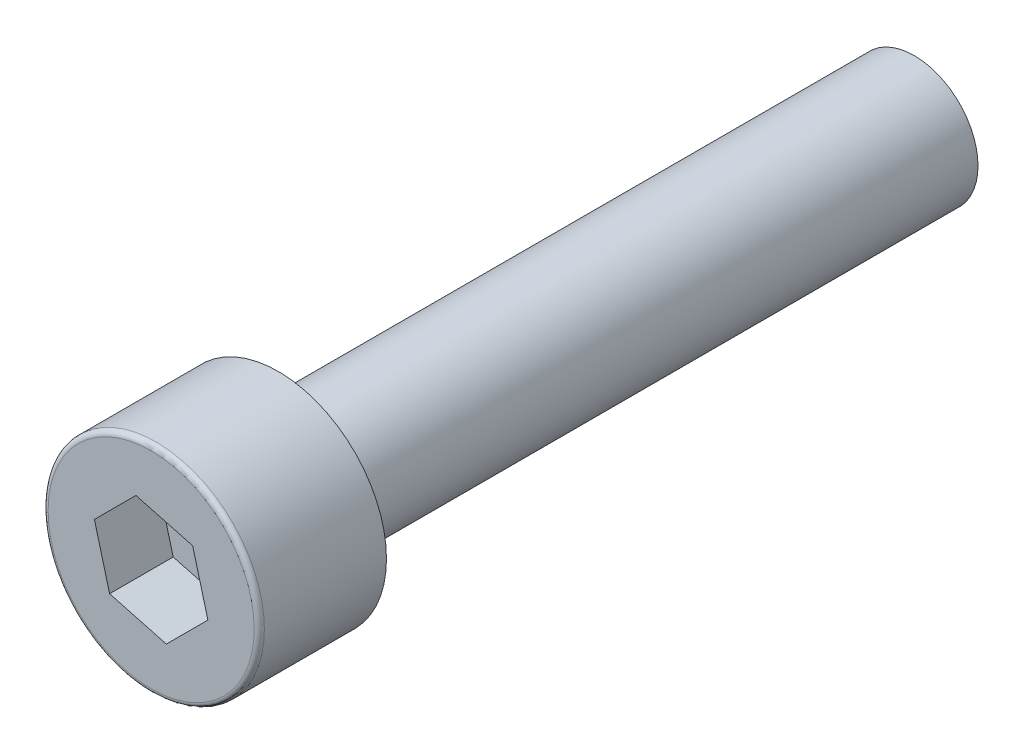
from build123d import *

# Parameters (mm, degrees)
SKETCH_1_R          = 4.25
EXTRUDE_1_DEPTH     = 5
CUT_EXTRUDE_1_DEPTH = 2.5
SKETCH_3_R          = 2.5
EXTRUDE_2_DEPTH     = 25
FILLET_1_R          = 0.2


with BuildPart() as part:
    # 草图1 → 凸台-拉伸1 (new body)
    with BuildSketch(Plane.XY):
        Circle(SKETCH_1_R)
    extrude(amount=EXTRUDE_1_DEPTH)

    # 草图2 → 切除-拉伸1 (cut)
    with BuildSketch(Plane.XY.offset(5)):
        Polygon((-1.632993162, -1.632993162), (0.597716981, -2.230710143), (2.230710143, -0.597716981), (1.632993162, 1.632993162), (-0.597716981, 2.230710143), (-2.230710143, 0.597716981), align=None)
    extrude(amount=-CUT_EXTRUDE_1_DEPTH, mode=Mode.SUBTRACT)

    # 草图3 → 凸台-拉伸2 (add)
    with BuildSketch(Plane(origin=(0, 0, 0), x_dir=(-1, 0, 0), z_dir=(0, 0, -1))):
        with Locations(Location((0, 0, 0), (0, 0, 180))):
            Circle(SKETCH_3_R)
    extrude(amount=EXTRUDE_2_DEPTH)

    # 圆角1
    fillet_1_edges = [part.edges().sort_by_distance(p)[0] for p in [
        (-4.25, 0, 5),
    ]]
    fillet(fillet_1_edges, radius=FILLET_1_R)


solid = part.part
